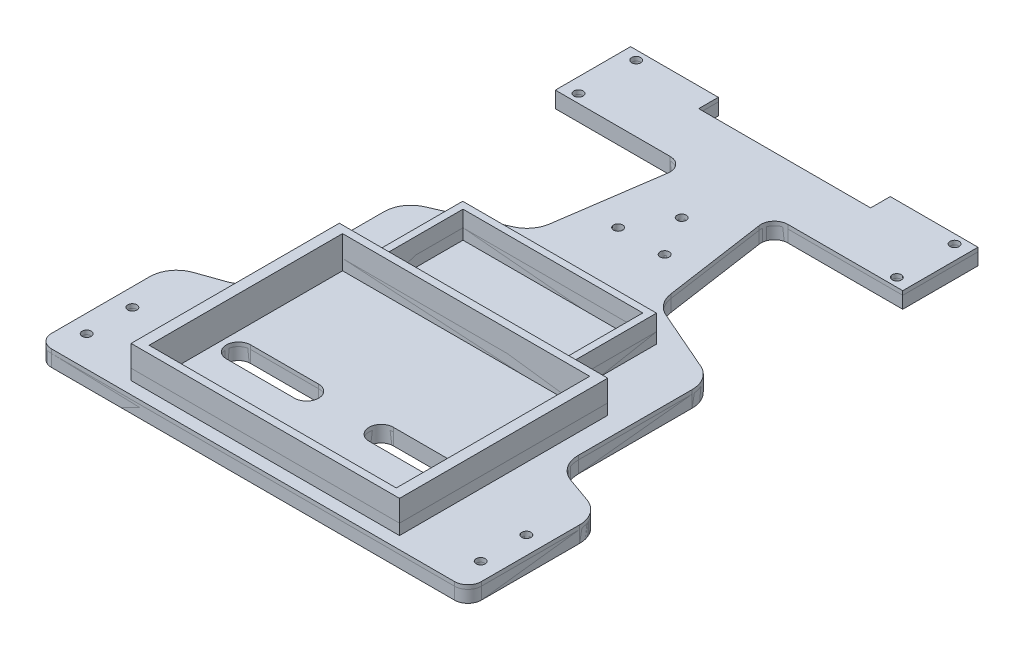
from build123d import *

# Parameters (mm, degrees)
SKETCH1_R                 = 1.7
BOSS_EXTRUDE2_DEPTH       = 6
SKETCH2_W                 = 99.896548796
SKETCH2_H                 = 77.504482918
SKETCH2_W_2               = 92
SKETCH2_H_2               = 72
BOSS_EXTRUDE3_DEPTH       = 12
BOSS_EXTRUDE7_DEPTH       = 10
BOSS_EXTRUDE9_DEPTH       = 4
BOSS_EXTRUDE9_DEPTH_BACK  = 2
SKETCH2_3_W               = 99.896548796
SKETCH2_3_H               = 77.504482918
SKETCH2_3_W_2             = 92
SKETCH2_3_H_2             = 72
BOSS_EXTRUDE10_DEPTH      = 0.001
BOSS_EXTRUDE10_DEPTH_BACK = 0.01
SKETCH1_3_R               = 1.7
BOSS_EXTRUDE11_DEPTH      = 4
BOSS_EXTRUDE11_DEPTH_BACK = 2
SKETCH1_5_R               = 1.7
BOSS_EXTRUDE13_DEPTH      = 4.5


with BuildPart() as part:
    # Sketch1 → Boss-Extrude2 (new body)
    with BuildSketch(Plane(origin=(0, 0, 0), x_dir=(1, 0, 0), z_dir=(0, 1, 0))):
        with BuildLine():
            Line((-80, -40.506084883), (-80, -77.075992242))
            ThreePointArc((-80, -77.075992242), (-78.535533906, -80.611526148), (-75, -82.075992242))
            Line((-75, -82.075992242), (75, -82.075992242))
            ThreePointArc((75, -82.075992242), (78.535533906, -80.611526148), (80, -77.075992242))
            Line((80, -77.075992242), (80, -40.506084883))
            ThreePointArc((80, -40.506084883), (78.162404985, -34.728962341), (73.324971027, -31.075042116))
            Line((73.324971027, -31.075042116), (64.019090233, -27.794197698))
            ThreePointArc((64.019090233, -27.794197698), (59.181656276, -24.140277473), (57.34406126, -18.363154931))
            Line((57.34406126, -18.363154931), (57.34406126, 24.026502157))
            ThreePointArc((57.34406126, 24.026502157), (55.709352713, 29.505726454), (51.33968148, 33.193563794))
            Line((51.33968148, 33.193563794), (28.448733327, 43.170974103))
            ThreePointArc((28.448733327, 43.170974103), (24.505586393, 46.257248285), (22.552965929, 50.868188471))
            Line((22.552965929, 50.868188471), (16.95839609, 89.384844275))
            ThreePointArc((16.95839609, 89.384844275), (18.124401576, 93.376382429), (21.906177851, 95.105576992))
            Line((21.906177851, 95.105576992), (64.655224225, 95.105576992))
            Line((64.655224225, 95.105576992), (64.655224225, 123.118859285))
            Line((64.655224225, 123.118859285), (32, 123.118859285))
            Line((32, 123.118859285), (32, 115.804418027))
            Line((32, 115.804418027), (-32, 115.804418027))
            Line((-32, 115.804418027), (-32, 123.118859285))
            Line((-32, 123.118859285), (-64.655224225, 123.118859285))
            Line((-64.655224225, 123.118859285), (-64.655224225, 95.105576992))
            Line((-64.655224225, 95.105576992), (-21.906177851, 95.105576992))
            ThreePointArc((-21.906177851, 95.105576992), (-18.124401576, 93.376382429), (-16.95839609, 89.384844275))
            Line((-16.95839609, 89.384844275), (-22.565992302, 50.889072401))
            ThreePointArc((-22.565992302, 50.889072401), (-24.514074738, 46.261143763), (-28.465935604, 43.163476197))
            Line((-28.465935604, 43.163476197), (-51.33968148, 33.193563794))
            ThreePointArc((-51.33968148, 33.193563794), (-55.709352713, 29.505726454), (-57.34406126, 24.026502157))
            Line((-57.34406126, 24.026502157), (-57.34406126, -18.363154931))
            ThreePointArc((-57.34406126, -18.363154931), (-59.181656276, -24.140277473), (-64.019090233, -27.794197698))
            Line((-64.019090233, -27.794197698), (-73.324971027, -31.075042116))
            ThreePointArc((-73.324971027, -31.075042116), (-78.162404985, -34.728962341), (-80, -40.506084883))
        make_face()
        with Locations((-59.25, 119.804418027)):
            Circle(SKETCH1_R, mode=Mode.SUBTRACT)
        with Locations((-59.25, 98.304418027)):
            Circle(SKETCH1_R, mode=Mode.SUBTRACT)
        with Locations((59.25, 98.304418027)):
            Circle(SKETCH1_R, mode=Mode.SUBTRACT)
        with Locations((59.25, 119.804418027)):
            Circle(SKETCH1_R, mode=Mode.SUBTRACT)
        with Locations((-73.324971027, -53.665404261)):
            Circle(SKETCH1_R, mode=Mode.SUBTRACT)
        with Locations((-73.324971027, -70.665404261)):
            Circle(SKETCH1_R, mode=Mode.SUBTRACT)
        with Locations((73.324971027, -70.665404261)):
            Circle(SKETCH1_R, mode=Mode.SUBTRACT)
        with Locations((73.324971027, -53.665404261)):
            Circle(SKETCH1_R, mode=Mode.SUBTRACT)
        with Locations((0, 77.481217249)):
            Circle(SKETCH1_R, mode=Mode.SUBTRACT)
        with Locations((-8.660254038, 62.481217249)):
            Circle(SKETCH1_R, mode=Mode.SUBTRACT)
        with Locations((8.660254038, 62.481217249)):
            Circle(SKETCH1_R, mode=Mode.SUBTRACT)
        with BuildLine():
            Line((13.891668225, -43.722847151), (39.23574333, -43.722847151))
            ThreePointArc((39.23574333, -43.722847151), (43.752087886, -48.239191707), (39.23574333, -52.755536263))
            Line((39.23574333, -52.755536263), (13.891668225, -52.755536263))
            ThreePointArc((13.891668225, -52.755536263), (9.375323669, -48.239191707), (13.891668225, -43.722847151))
        make_face(mode=Mode.SUBTRACT)
        with BuildLine():
            Line((-13.891668225, -43.722847151), (-39.23574333, -43.722847151))
            ThreePointArc((-39.23574333, -43.722847151), (-43.752087886, -48.239191707), (-39.23574333, -52.755536263))
            Line((-39.23574333, -52.755536263), (-13.891668225, -52.755536263))
            ThreePointArc((-13.891668225, -52.755536263), (-9.375323669, -48.239191707), (-13.891668225, -43.722847151))
        make_face(mode=Mode.SUBTRACT)
    extrude(amount=BOSS_EXTRUDE2_DEPTH)

    # Sketch2 → Boss-Extrude3 (add)
    with BuildSketch(Plane(origin=(0, 6, 0), x_dir=(1, 0, 0), z_dir=(0, 1, 0))):
        with Locations((0, -38.752241459)):
            Rectangle(SKETCH2_W, SKETCH2_H)
        with Locations((0, -38.752241459)):
            Rectangle(SKETCH2_W_2, SKETCH2_H_2, mode=Mode.SUBTRACT)
    extrude(amount=BOSS_EXTRUDE3_DEPTH)

    # Sketch8 → Boss-Extrude7 (add)
    with BuildSketch(Plane(origin=(0, 6, 0), x_dir=(1, 0, 0), z_dir=(0, 1, 0))):
        Polygon((-36.068150027, 32.037520474), (-36.068150027, 0.037520474), (-33.460801269, 0.037520474), (-33.460801269, 29.542406433), (33.460801269, 29.542406433), (33.460801269, 0.037520474), (36.068150027, 0.037520474), (36.068150027, 32.037520474), align=None)
    extrude(amount=BOSS_EXTRUDE7_DEPTH)


with BuildPart() as body_2:
    # Sketch2<3> → Boss-Extrude9 (new, two sides: drawn at the far end of the back side and taken through both)
    with BuildSketch(Plane(origin=(0, 6, 0), x_dir=(1, 0, 0), z_dir=(0, 1, 0)).offset(-BOSS_EXTRUDE9_DEPTH_BACK)):
        with Locations((0, -38.752241459)):
            Rectangle(SKETCH2_3_W, SKETCH2_3_H)
        with Locations((0, -38.752241459)):
            Rectangle(SKETCH2_3_W_2, SKETCH2_3_H_2, mode=Mode.SUBTRACT)
    extrude(amount=BOSS_EXTRUDE9_DEPTH + BOSS_EXTRUDE9_DEPTH_BACK)

    # Sketch1<5> → Boss-Extrude13 (add)
    with BuildSketch(Plane(origin=(0, 0, 0), x_dir=(1, 0, 0), z_dir=(0, 1, 0))):
        with BuildLine():
            Line((-80, -40.506084883), (-80, -77.075992242))
            ThreePointArc((-80, -77.075992242), (-78.535533906, -80.611526148), (-75, -82.075992242))
            Line((-75, -82.075992242), (75, -82.075992242))
            ThreePointArc((75, -82.075992242), (78.535533906, -80.611526148), (80, -77.075992242))
            Line((80, -77.075992242), (80, -40.506084883))
            ThreePointArc((80, -40.506084883), (78.162404985, -34.728962341), (73.324971027, -31.075042116))
            Line((73.324971027, -31.075042116), (64.019090233, -27.794197698))
            ThreePointArc((64.019090233, -27.794197698), (59.181656276, -24.140277473), (57.34406126, -18.363154931))
            Line((57.34406126, -18.363154931), (57.34406126, 24.026502157))
            ThreePointArc((57.34406126, 24.026502157), (55.709352713, 29.505726454), (51.33968148, 33.193563794))
            Line((51.33968148, 33.193563794), (28.448733327, 43.170974103))
            ThreePointArc((28.448733327, 43.170974103), (24.505586393, 46.257248285), (22.552965929, 50.868188471))
            Line((22.552965929, 50.868188471), (16.95839609, 89.384844275))
            ThreePointArc((16.95839609, 89.384844275), (18.124401576, 93.376382429), (21.906177851, 95.105576992))
            Line((21.906177851, 95.105576992), (64.655224225, 95.105576992))
            Line((64.655224225, 95.105576992), (64.655224225, 123.118859285))
            Line((64.655224225, 123.118859285), (32, 123.118859285))
            Line((32, 123.118859285), (32, 115.804418027))
            Line((32, 115.804418027), (-32, 115.804418027))
            Line((-32, 115.804418027), (-32, 123.118859285))
            Line((-32, 123.118859285), (-64.655224225, 123.118859285))
            Line((-64.655224225, 123.118859285), (-64.655224225, 95.105576992))
            Line((-64.655224225, 95.105576992), (-21.906177851, 95.105576992))
            ThreePointArc((-21.906177851, 95.105576992), (-18.124401576, 93.376382429), (-16.95839609, 89.384844275))
            Line((-16.95839609, 89.384844275), (-22.565992302, 50.889072401))
            ThreePointArc((-22.565992302, 50.889072401), (-24.514074738, 46.261143763), (-28.465935604, 43.163476197))
            Line((-28.465935604, 43.163476197), (-51.33968148, 33.193563794))
            ThreePointArc((-51.33968148, 33.193563794), (-55.709352713, 29.505726454), (-57.34406126, 24.026502157))
            Line((-57.34406126, 24.026502157), (-57.34406126, -18.363154931))
            ThreePointArc((-57.34406126, -18.363154931), (-59.181656276, -24.140277473), (-64.019090233, -27.794197698))
            Line((-64.019090233, -27.794197698), (-73.324971027, -31.075042116))
            ThreePointArc((-73.324971027, -31.075042116), (-78.162404985, -34.728962341), (-80, -40.506084883))
        make_face()
        with Locations((-59.25, 119.804418027)):
            Circle(SKETCH1_5_R, mode=Mode.SUBTRACT)
        with Locations((-59.25, 98.304418027)):
            Circle(SKETCH1_5_R, mode=Mode.SUBTRACT)
        with Locations((59.25, 98.304418027)):
            Circle(SKETCH1_5_R, mode=Mode.SUBTRACT)
        with Locations((59.25, 119.804418027)):
            Circle(SKETCH1_5_R, mode=Mode.SUBTRACT)
        with Locations((-73.324971027, -53.665404261)):
            Circle(SKETCH1_5_R, mode=Mode.SUBTRACT)
        with Locations((-73.324971027, -70.665404261)):
            Circle(SKETCH1_5_R, mode=Mode.SUBTRACT)
        with Locations((73.324971027, -70.665404261)):
            Circle(SKETCH1_5_R, mode=Mode.SUBTRACT)
        with Locations((73.324971027, -53.665404261)):
            Circle(SKETCH1_5_R, mode=Mode.SUBTRACT)
        with Locations((0, 77.481217249)):
            Circle(SKETCH1_5_R, mode=Mode.SUBTRACT)
        with Locations((-8.660254038, 62.481217249)):
            Circle(SKETCH1_5_R, mode=Mode.SUBTRACT)
        with Locations((8.660254038, 62.481217249)):
            Circle(SKETCH1_5_R, mode=Mode.SUBTRACT)
        with BuildLine():
            Line((13.891668225, -43.722847151), (39.23574333, -43.722847151))
            ThreePointArc((39.23574333, -43.722847151), (43.752087886, -48.239191707), (39.23574333, -52.755536263))
            Line((39.23574333, -52.755536263), (13.891668225, -52.755536263))
            ThreePointArc((13.891668225, -52.755536263), (9.375323669, -48.239191707), (13.891668225, -43.722847151))
        make_face(mode=Mode.SUBTRACT)
        with BuildLine():
            Line((-13.891668225, -43.722847151), (-39.23574333, -43.722847151))
            ThreePointArc((-39.23574333, -43.722847151), (-43.752087886, -48.239191707), (-39.23574333, -52.755536263))
            Line((-39.23574333, -52.755536263), (-13.891668225, -52.755536263))
            ThreePointArc((-13.891668225, -52.755536263), (-9.375323669, -48.239191707), (-13.891668225, -43.722847151))
        make_face(mode=Mode.SUBTRACT)
    extrude(amount=BOSS_EXTRUDE13_DEPTH)


with BuildPart() as body_3:
    # Sketch1<3> → Boss-Extrude10 (new, two sides: drawn at the far end of the back side and taken through both)
    with BuildSketch(Plane(origin=(0, 0, 0), x_dir=(1, 0, 0), z_dir=(0, 1, 0)).offset(-BOSS_EXTRUDE10_DEPTH_BACK)):
        with BuildLine():
            Line((-80, -40.506084883), (-80, -77.075992242))
            ThreePointArc((-80, -77.075992242), (-78.535533906, -80.611526148), (-75, -82.075992242))
            Line((-75, -82.075992242), (75, -82.075992242))
            ThreePointArc((75, -82.075992242), (78.535533906, -80.611526148), (80, -77.075992242))
            Line((80, -77.075992242), (80, -40.506084883))
            ThreePointArc((80, -40.506084883), (78.162404985, -34.728962341), (73.324971027, -31.075042116))
            Line((73.324971027, -31.075042116), (64.019090233, -27.794197698))
            ThreePointArc((64.019090233, -27.794197698), (59.181656276, -24.140277473), (57.34406126, -18.363154931))
            Line((57.34406126, -18.363154931), (57.34406126, 24.026502157))
            ThreePointArc((57.34406126, 24.026502157), (55.709352713, 29.505726454), (51.33968148, 33.193563794))
            Line((51.33968148, 33.193563794), (28.448733327, 43.170974103))
            ThreePointArc((28.448733327, 43.170974103), (24.505586393, 46.257248285), (22.552965929, 50.868188471))
            Line((22.552965929, 50.868188471), (16.95839609, 89.384844275))
            ThreePointArc((16.95839609, 89.384844275), (18.124401576, 93.376382429), (21.906177851, 95.105576992))
            Line((21.906177851, 95.105576992), (64.655224225, 95.105576992))
            Line((64.655224225, 95.105576992), (64.655224225, 123.118859285))
            Line((64.655224225, 123.118859285), (32, 123.118859285))
            Line((32, 123.118859285), (32, 115.804418027))
            Line((32, 115.804418027), (-32, 115.804418027))
            Line((-32, 115.804418027), (-32, 123.118859285))
            Line((-32, 123.118859285), (-64.655224225, 123.118859285))
            Line((-64.655224225, 123.118859285), (-64.655224225, 95.105576992))
            Line((-64.655224225, 95.105576992), (-21.906177851, 95.105576992))
            ThreePointArc((-21.906177851, 95.105576992), (-18.124401576, 93.376382429), (-16.95839609, 89.384844275))
            Line((-16.95839609, 89.384844275), (-22.565992302, 50.889072401))
            ThreePointArc((-22.565992302, 50.889072401), (-24.514074738, 46.261143763), (-28.465935604, 43.163476197))
            Line((-28.465935604, 43.163476197), (-51.33968148, 33.193563794))
            ThreePointArc((-51.33968148, 33.193563794), (-55.709352713, 29.505726454), (-57.34406126, 24.026502157))
            Line((-57.34406126, 24.026502157), (-57.34406126, -18.363154931))
            ThreePointArc((-57.34406126, -18.363154931), (-59.181656276, -24.140277473), (-64.019090233, -27.794197698))
            Line((-64.019090233, -27.794197698), (-73.324971027, -31.075042116))
            ThreePointArc((-73.324971027, -31.075042116), (-78.162404985, -34.728962341), (-80, -40.506084883))
        make_face()
        with Locations((-59.25, 119.804418027)):
            Circle(SKETCH1_3_R, mode=Mode.SUBTRACT)
        with Locations((-59.25, 98.304418027)):
            Circle(SKETCH1_3_R, mode=Mode.SUBTRACT)
        with Locations((59.25, 98.304418027)):
            Circle(SKETCH1_3_R, mode=Mode.SUBTRACT)
        with Locations((59.25, 119.804418027)):
            Circle(SKETCH1_3_R, mode=Mode.SUBTRACT)
        with Locations((-73.324971027, -53.665404261)):
            Circle(SKETCH1_3_R, mode=Mode.SUBTRACT)
        with Locations((-73.324971027, -70.665404261)):
            Circle(SKETCH1_3_R, mode=Mode.SUBTRACT)
        with Locations((73.324971027, -70.665404261)):
            Circle(SKETCH1_3_R, mode=Mode.SUBTRACT)
        with Locations((73.324971027, -53.665404261)):
            Circle(SKETCH1_3_R, mode=Mode.SUBTRACT)
        with Locations((0, 77.481217249)):
            Circle(SKETCH1_3_R, mode=Mode.SUBTRACT)
        with Locations((-8.660254038, 62.481217249)):
            Circle(SKETCH1_3_R, mode=Mode.SUBTRACT)
        with Locations((8.660254038, 62.481217249)):
            Circle(SKETCH1_3_R, mode=Mode.SUBTRACT)
        with BuildLine():
            Line((13.891668225, -43.722847151), (39.23574333, -43.722847151))
            ThreePointArc((39.23574333, -43.722847151), (43.752087886, -48.239191707), (39.23574333, -52.755536263))
            Line((39.23574333, -52.755536263), (13.891668225, -52.755536263))
            ThreePointArc((13.891668225, -52.755536263), (9.375323669, -48.239191707), (13.891668225, -43.722847151))
        make_face(mode=Mode.SUBTRACT)
        with BuildLine():
            Line((-13.891668225, -43.722847151), (-39.23574333, -43.722847151))
            ThreePointArc((-39.23574333, -43.722847151), (-43.752087886, -48.239191707), (-39.23574333, -52.755536263))
            Line((-39.23574333, -52.755536263), (-13.891668225, -52.755536263))
            ThreePointArc((-13.891668225, -52.755536263), (-9.375323669, -48.239191707), (-13.891668225, -43.722847151))
        make_face(mode=Mode.SUBTRACT)
    extrude(amount=BOSS_EXTRUDE10_DEPTH + BOSS_EXTRUDE10_DEPTH_BACK)


with BuildPart() as body_4:
    # Sketch8<9> → Boss-Extrude11 (new, two sides: drawn at the far end of the back side and taken through both)
    with BuildSketch(Plane(origin=(0, 6, 0), x_dir=(1, 0, 0), z_dir=(0, 1, 0)).offset(-BOSS_EXTRUDE11_DEPTH_BACK)):
        Polygon((-36.068150027, 32.037520474), (-36.068150027, 0.037520474), (-33.460801269, 0.037520474), (-33.460801269, 29.542406433), (33.460801269, 29.542406433), (33.460801269, 0.037520474), (36.068150027, 0.037520474), (36.068150027, 32.037520474), align=None)
    extrude(amount=BOSS_EXTRUDE11_DEPTH + BOSS_EXTRUDE11_DEPTH_BACK)


solid = Compound([part.part, body_2.part, body_3.part, body_4.part])
